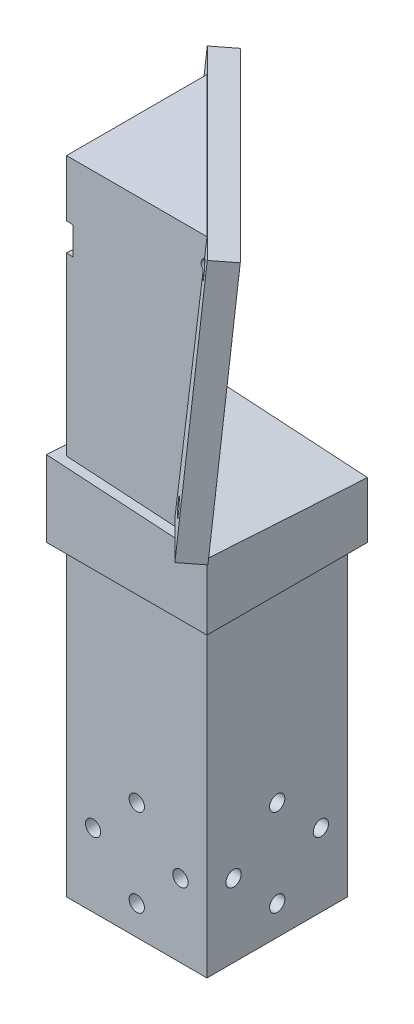
from build123d import *

# Parameters (mm, degrees)
SKETCH1_W               = 30.562599784
SKETCH1_H               = 30.562599784
BOSS_EXTRUDE1_DEPTH     = 139.7
CUT_EXTRUDE1_DEPTH      = 142.361685943
CUT_EXTRUDE1_DEPTH_BACK = 142.361685943
BOSS_EXTRUDE2_DEPTH     = 5.09983
SKETCH5_R               = 1.8
CUT_EXTRUDE2_DEPTH      = 146.354775845
SKETCH6_R               = 1.662500104
CUT_EXTRUDE3_DEPTH      = 145.138064655
BOSS_EXTRUDE3_REACH     = 212.94
BOSS_EXTRUDE3_START     = 66.802
SKETCH8_W               = 34.925
SKETCH8_H               = 34.925
SKETCH8_W_2             = 30.562599784
SKETCH8_H_2             = 30.562599784


with BuildPart() as part:
    # Sketch1 → Boss-Extrude1 (new body)
    with BuildSketch(Plane(origin=(0, 0, 0), x_dir=(1, 0, 0), z_dir=(0, 1, 0))):
        Rectangle(SKETCH1_W, SKETCH1_H)
    extrude(amount=BOSS_EXTRUDE1_DEPTH)

    # Sketch2 → Cut-Extrude1 (cut, two sides: drawn at the far end of the back side and taken through both)
    with BuildSketch(Plane(origin=(0, 0, 0), x_dir=(0, -1, 0), z_dir=(-0.7071067811865438, 0, -0.7071067811865512)).offset(-CUT_EXTRUDE1_DEPTH_BACK)):
        Polygon((-139.7, -5.11931044), (-81.186013921, 0), (-79.295294527, -21.611021558), (-139.7, -21.611021558), align=None)
    extrude(amount=CUT_EXTRUDE1_DEPTH + CUT_EXTRUDE1_DEPTH_BACK, mode=Mode.SUBTRACT)

    # Sketch4 → Boss-Extrude2 (add)
    with BuildSketch(Plane(origin=(-4.984326181, 0.616698988, 4.984326181), x_dir=(-0.6990962056889038, 0.08640854919208918, -0.7097873328102555), z_dir=(0.7044160264027624, -0.08715574274765817, -0.704416026402755))):
        Polygon((40.57727892, 136.609827857), (-16.357328672, 141.566939751), (-21.314440566, 84.632332159), (35.620167026, 79.675220265), align=None)
    extrude(amount=-BOSS_EXTRUDE2_DEPTH)

    # Sketch5 → Cut-Extrude2 (cut, through all)
    with BuildSketch(Plane(origin=(-4.984326181, 0.616698988, 4.984326181), x_dir=(-0.6990962056889037, 0.0864085491920891, -0.7097873328102555), z_dir=(0.7044160264027625, -0.08715574274765821, -0.7044160264027549))):
        with Locations(Location((33.998237872, 131.084660992, 0), (0, 0, 355.023990467))):
            Circle(SKETCH5_R)
        with Locations(Location((-10.832161807, 134.987898703, 0), (0, 0, 355.023990467))):
            Circle(SKETCH5_R)
        with Locations(Location((-14.735399518, 90.157499024, 0), (0, 0, 355.023990467))):
            Circle(SKETCH5_R)
        with Locations(Location((30.095000161, 86.254261313, 0), (0, 0, 355.023990467))):
            Circle(SKETCH5_R)
        Polygon((19.811839734, 123.787667921), (9.849528694, 124.65505408), (9.329097, 118.677667456), (19.291408039, 117.810281298), align=None)
    extrude(amount=-CUT_EXTRUDE2_DEPTH, mode=Mode.SUBTRACT)

    # Sketch6 → Cut-Extrude3 (cut, symmetric)
    with BuildSketch(Plane(origin=(0, 0, 0), x_dir=(0, 0, -1), z_dir=(1, 0, 0))):
        with Locations(Location((0, 25.4, 0), (0, 0, 180))):
            Circle(SKETCH6_R)
        with Locations(Location((-9.5, 15.9, 0), (0, 0, 180))):
            Circle(SKETCH6_R)
        with Locations(Location((9.5, 15.9, 0), (0, 0, 180))):
            Circle(SKETCH6_R)
        with Locations(Location((0, 6.4, 0), (0, 0, 180))):
            Circle(SKETCH6_R)
    cut_extrude3 = extrude(amount=CUT_EXTRUDE3_DEPTH, both=True, mode=Mode.SUBTRACT)

    # Mirror1: Cut-Extrude3 across plane
    add(cut_extrude3.mirror(Plane(origin=(0, 0, 0), x_dir=(-0.7071067811865512, 0, 0.7071067811865439), z_dir=(-0.7071067811865438, 0, -0.7071067811865512))), mode=Mode.SUBTRACT)

    # Boss-Extrude3: up to this plane
    boss_extrude3_end = Plane(origin=(15.281299892, 81.186013921, 15.281299892), z_dir=(-0.06162841671621989, -0.9961946980917455, 0.061628416716219235))
    # Sketch8 → Boss-Extrude3 (add, up to the surface)
    with BuildSketch(Plane(origin=(0, 0, 0), x_dir=(1, 0, 0), z_dir=(0, 1, 0)).offset(BOSS_EXTRUDE3_START), mode=Mode.PRIVATE) as boss_extrude3_sk1:
        Rectangle(SKETCH8_W, SKETCH8_H)
        Rectangle(SKETCH8_W_2, SKETCH8_H_2, mode=Mode.SUBTRACT)
    boss_extrude3_tool1 = split(extrude(boss_extrude3_sk1.sketch, amount=BOSS_EXTRUDE3_REACH, mode=Mode.PRIVATE), bisect_by=boss_extrude3_end, keep=Keep.BOTH, mode=Mode.PRIVATE)
    add(boss_extrude3_tool1.solids().sort_by_distance((0, 66.802, 16.968586))[0])


solid = part.part
